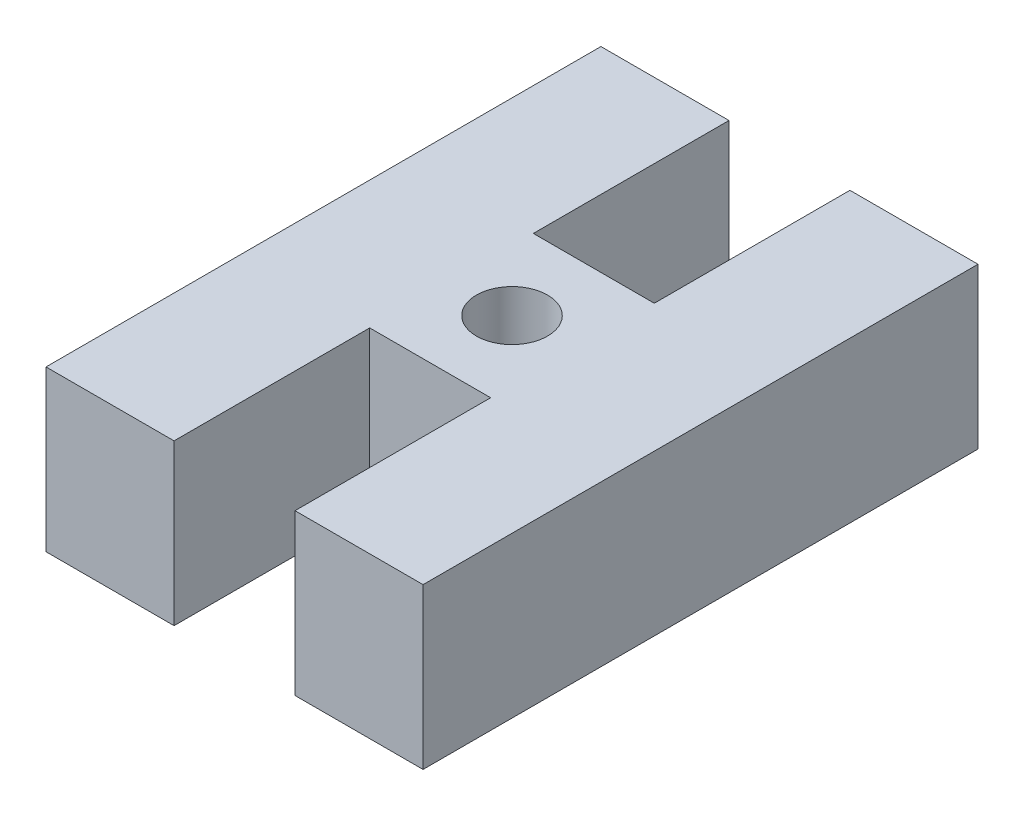
from build123d import *

# Parameters (mm, degrees)
BOSS_EXTRU_1_DEPTH      = 4.5
ESQUISSE2_R             = 1
ENL_V_MAT_EXTRU_1_DEPTH = 11.44892339


with BuildPart() as part:
    # Esquisse1 → Boss.-Extru.1 (new body)
    with BuildSketch(Plane(origin=(0, 0, 0), x_dir=(1, 0, 0), z_dir=(0, 1, 0))):
        Polygon((-5.3, -7.8), (-5.3, 7.8), (-1.7, 7.8), (-1.7, 2.3), (1.7, 2.3), (1.7, 7.8), (5.3, 7.8), (5.3, -7.8), (1.7, -7.8), (1.7, -2.3), (-1.7, -2.3), (-1.7, -7.8), align=None)
    extrude(amount=BOSS_EXTRU_1_DEPTH)

    # Esquisse2 → Enlèv. mat.-Extru.1 (cut, through all)
    with BuildSketch(Plane(origin=(0, 4.5, 0), x_dir=(1, 0, 0), z_dir=(0, 1, 0))):
        with Locations(Location((0, 0, 0), (0, 0, 270))):
            Circle(ESQUISSE2_R)
    extrude(amount=-ENL_V_MAT_EXTRU_1_DEPTH, mode=Mode.SUBTRACT)


solid = part.part
